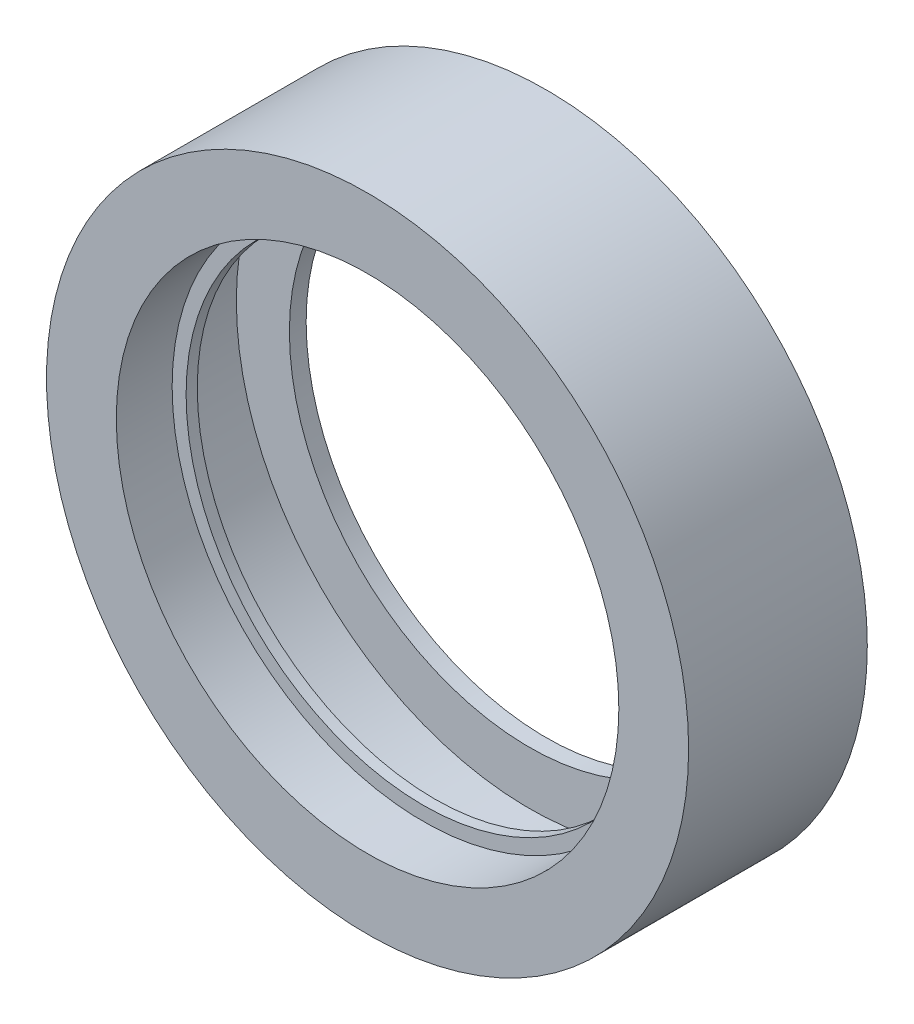
from build123d import *

# Parameters (mm, degrees)
SKETCH1_R           = 57.5
SKETCH1_R_2         = 52.5
BOSS_EXTRUDE1_DEPTH = 32
SKETCH3_R           = 52.5
SKETCH3_R_2         = 45
SKETCH3_R_3         = 35
BOSS_EXTRUDE3_DEPTH = 12
SKETCH7_R           = 45
SKETCH7_R_2         = 42.5
BOSS_EXTRUDE4_DEPTH = 2
SKETCH10_R          = 52.5
SKETCH10_R_2        = 43
BOSS_EXTRUDE5_DEPTH = 3


with BuildPart() as part:
    # Sketch1 → Boss-Extrude1 (new body)
    with BuildSketch(Plane.XY):
        Circle(SKETCH1_R)
        Circle(SKETCH1_R_2, mode=Mode.SUBTRACT)
    extrude(amount=BOSS_EXTRUDE1_DEPTH)

    # Sketch3 → Boss-Extrude3 (add)
    # profile 1 of 2: a face of its own
    with BuildSketch(Plane.XY.offset(20)):
        Circle(SKETCH3_R)
        Circle(SKETCH3_R_2, mode=Mode.SUBTRACT)
    # profile 2 of 2: a face of its own
    with BuildSketch(Plane.XY.offset(20)):
        Circle(SKETCH3_R_3)
    extrude(amount=BOSS_EXTRUDE3_DEPTH)


with BuildPart() as boss_extrude3_kept_piece:
    # of the separate pieces the step leaves, the one the design keeps (boss_extrude3_pieces_kept)
    add(part.part.solids().sort_by_distance((57.5, 0, 0))[0])

    # Sketch7 → Boss-Extrude4 (add)
    with BuildSketch(Plane.XY.offset(20)):
        Circle(SKETCH7_R)
        Circle(SKETCH7_R_2, mode=Mode.SUBTRACT)
    extrude(amount=BOSS_EXTRUDE4_DEPTH)

    # Sketch10 → Boss-Extrude5 (add)
    with BuildSketch(Plane(origin=(0, 0, 0), x_dir=(-1, 0, 0), z_dir=(0, 0, -1))):
        Circle(SKETCH10_R)
        Circle(SKETCH10_R_2, mode=Mode.SUBTRACT)
    extrude(amount=-BOSS_EXTRUDE5_DEPTH)


solid = boss_extrude3_kept_piece.part
